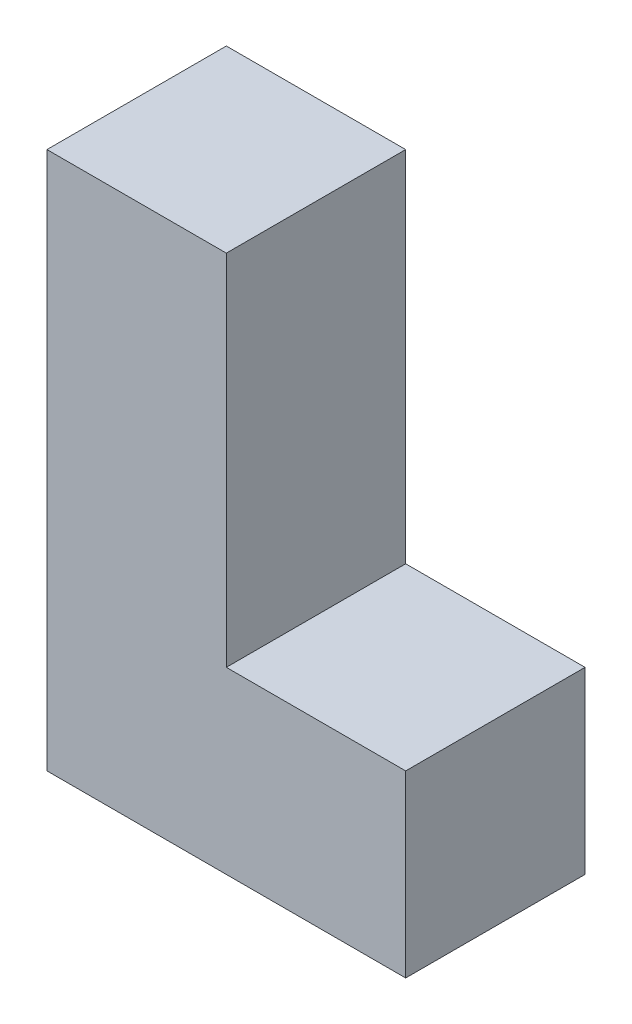
from build123d import *

# Parameters (mm, degrees)
BOSS_EXTRU_1_DEPTH = 10


with BuildPart() as part:
    # Esquisse1 → Boss.-Extru.1 (new body)
    with BuildSketch(Plane.XY):
        Polygon((0, 0), (0, 30), (10, 30), (10, 10), (20, 10), (20, 0), align=None)
    extrude(amount=-BOSS_EXTRU_1_DEPTH)


solid = part.part
